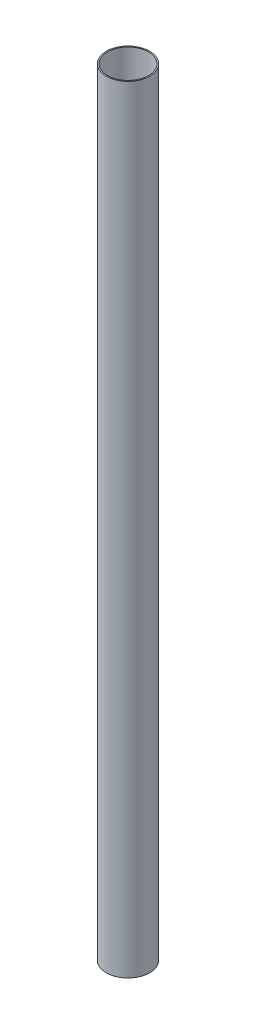
from build123d import *

# Parameters (mm, degrees)
SKETCH1_W = 1.524
SKETCH1_H = 1019.9878


with BuildPart() as part:
    # Sketch1 → Revolve1 (revolve)
    with BuildSketch(Plane.XY, mode=Mode.PRIVATE) as revolve1_sk:
        with Locations((27.7368, 509.9939)):
            Rectangle(SKETCH1_W, SKETCH1_H)
    revolve(revolve1_sk.sketch.rotate(Axis((0, 1146.81, 0), (0, -1, 0)), 90), axis=Axis((0, 1146.81, 0), (0, -1, 0)))


solid = part.part
